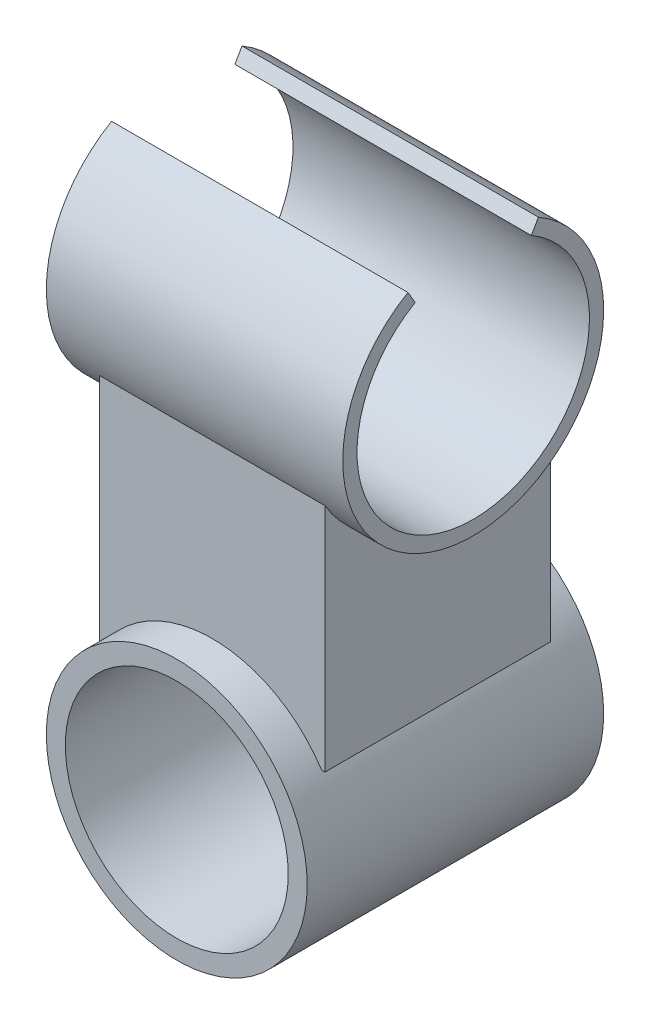
from build123d import *

# Parameters (mm, degrees)
BOSS_EXTRUDE1_DEPTH = 12.5
SKETCH3_W           = 19
SKETCH3_H           = 19
SKETCH3_W_2         = 15.8
SKETCH3_H_2         = 15.8
BOSS_EXTRUDE3_DEPTH = 25
SKETCH2_R           = 11
SKETCH2_R_2         = 9.4
BOSS_EXTRUDE2_DEPTH = 12.5
SKETCH4_R           = 9.8
CUT_EXTRUDE1_DEPTH  = 20
SKETCH5_R           = 9.4
CUT_EXTRUDE2_DEPTH  = 20


with BuildPart() as part:
    # Sketch1 → Boss-Extrude1 (new, symmetric)
    with BuildSketch(Plane(origin=(0, 0, 0), x_dir=(0, 0, -1), z_dir=(1, 0, 0))):
        with BuildLine():
            Line((-5.5, 9.526279442), (-4.9, 8.487048957))
            ThreePointArc((-4.9, 8.487048957), (0, -9.8), (4.9, 8.487048957))
            Line((4.9, 8.487048957), (5.5, 9.526279442))
            ThreePointArc((5.5, 9.526279442), (0, -11), (-5.5, 9.526279442))
        make_face()
    extrude(amount=BOSS_EXTRUDE1_DEPTH, both=True)

    # Sketch3 → Boss-Extrude3 (add)
    with BuildSketch(Plane(origin=(0, 0, 0), x_dir=(1, 0, 0), z_dir=(0, 1, 0))):
        Rectangle(SKETCH3_W, SKETCH3_H)
        Rectangle(SKETCH3_W_2, SKETCH3_H_2, mode=Mode.SUBTRACT)
    extrude(amount=-BOSS_EXTRUDE3_DEPTH)

    # Sketch2 → Boss-Extrude2 (add, symmetric)
    with BuildSketch(Plane.XY):
        with Locations((0, -31)):
            Circle(SKETCH2_R)
        with Locations((0, -31)):
            Circle(SKETCH2_R_2, mode=Mode.SUBTRACT)
    extrude(amount=BOSS_EXTRUDE2_DEPTH, both=True)

    # Sketch4 → Cut-Extrude1 (cut, symmetric)
    with BuildSketch(Plane(origin=(0, 0, 0), x_dir=(0, 0, -1), z_dir=(1, 0, 0))):
        Circle(SKETCH4_R)
    extrude(amount=CUT_EXTRUDE1_DEPTH, both=True, mode=Mode.SUBTRACT)

    # Sketch5 → Cut-Extrude2 (cut, symmetric)
    with BuildSketch(Plane.XY):
        with Locations((0, -31)):
            Circle(SKETCH5_R)
    extrude(amount=CUT_EXTRUDE2_DEPTH, both=True, mode=Mode.SUBTRACT)


solid = part.part
